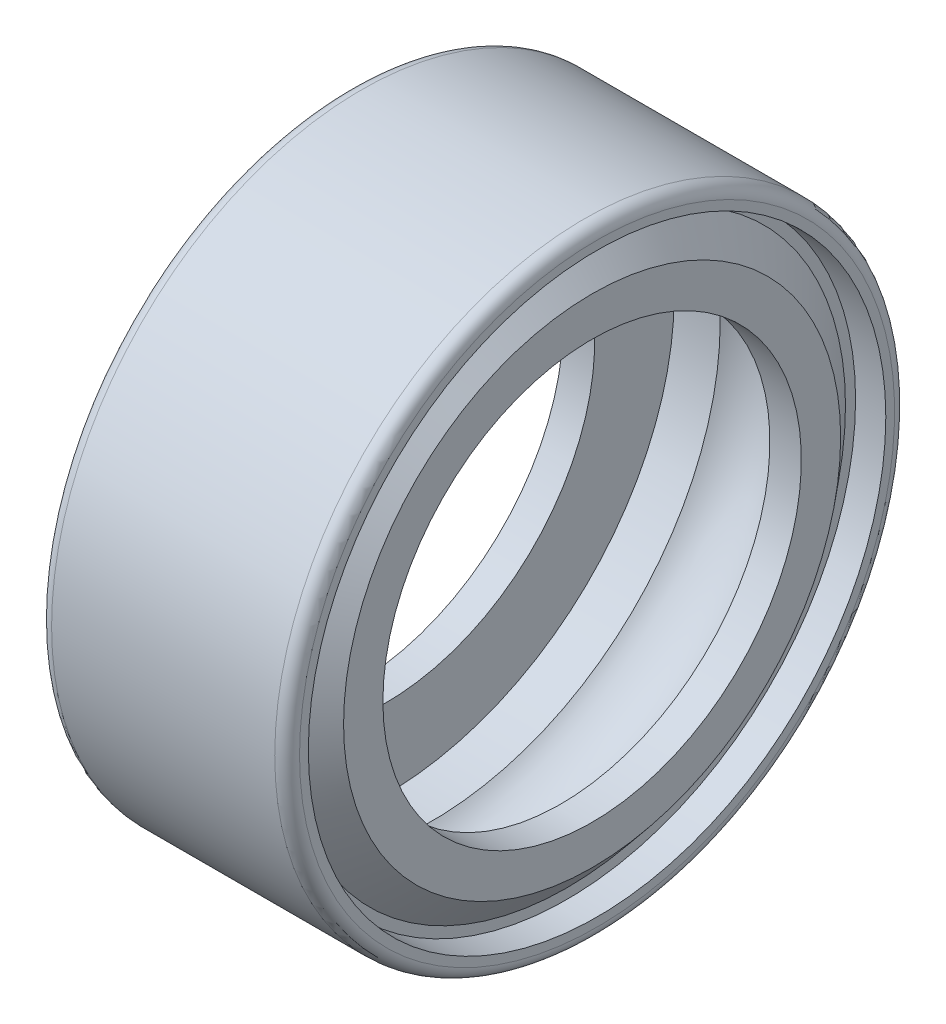
from build123d import *


with BuildPart() as part:
    # Sketch1 → Revolve1 (revolve)
    with BuildSketch(Plane(origin=(0, 0, 0), x_dir=(-1, 0, 0), z_dir=(0, 0, -1)), mode=Mode.PRIVATE) as revolve1_sk:
        with BuildLine():
            Line((1.524, 3.182551134), (1.200668646, 3.567882438))
            Line((1.200668646, 3.567882438), (1.200668646, 3.6972875))
            Line((1.200668646, 3.6972875), (1.5875, 3.6972875))
            Line((1.5875, 3.6972875), (1.5875, 3.81))
            ThreePointArc((1.5875, 3.81), (1.541003202, 3.922253202), (1.42875, 3.96875))
            Line((1.42875, 3.96875), (-1.42875, 3.96875))
            ThreePointArc((-1.42875, 3.96875), (-1.541003202, 3.922253202), (-1.5875, 3.81))
            Line((-1.5875, 3.81), (-1.5875, 3.6972875))
            Line((-1.5875, 3.6972875), (-1.200668646, 3.6972875))
            Line((-1.200668646, 3.6972875), (-1.200668646, 3.567882438))
            Line((-1.200668646, 3.567882438), (-1.524, 3.182551134))
            Line((-1.524, 3.182551134), (-1.524, 2.679239625))
            Line((-1.524, 2.679239625), (-1.121293646, 2.679239625))
            Line((-1.121293646, 2.679239625), (-1.121293646, 3.6972875))
            Line((-1.121293646, 3.6972875), (-0.532839829, 3.6972875))
            ThreePointArc((-0.532839829, 3.6972875), (0, 3.921125), (0.532839829, 3.6972875))
            Line((0.532839829, 3.6972875), (1.121293646, 3.6972875))
            Line((1.121293646, 3.6972875), (1.121293646, 2.679239625))
            Line((1.121293646, 2.679239625), (1.524, 2.679239625))
            Line((1.524, 2.679239625), (1.524, 3.182551134))
        make_face()
    revolve(revolve1_sk.sketch.rotate(Axis((1.5875, 0, 0), (-1, 0, 0)), 270), axis=Axis((1.5875, 0, 0), (-1, 0, 0)))


solid = part.part
